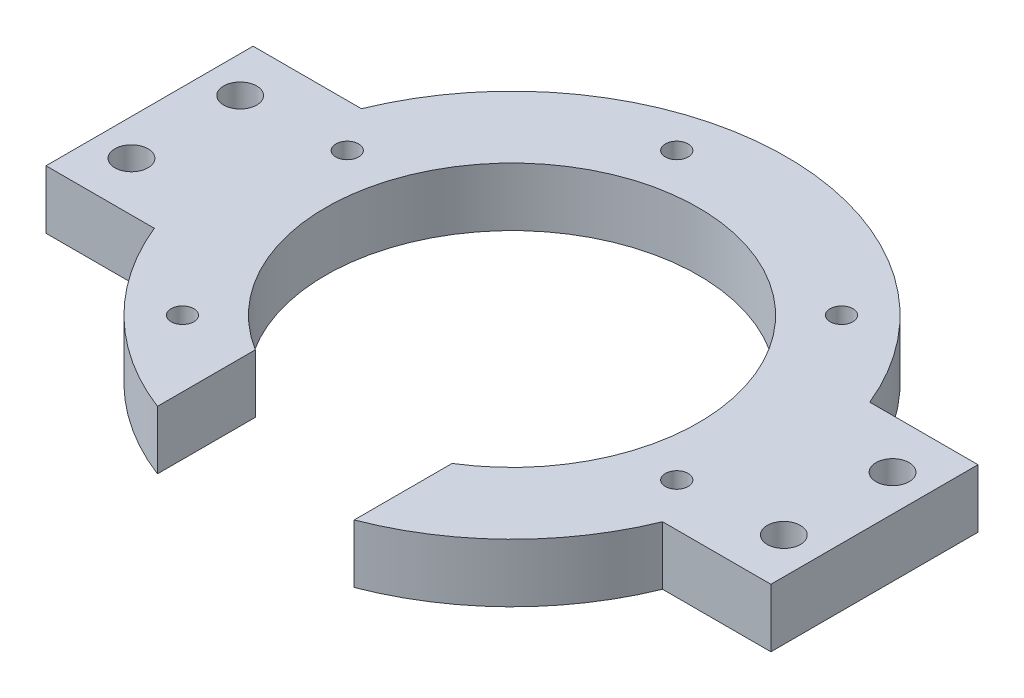
from build123d import *

# Parameters (mm, degrees)
SKETCH1_W                                  = 53
SKETCH1_H                                  = 11.3
SKETCH2_R                                  = 36
CUT_EXTRUDE1_DEPTH                         = 11.3
SKETCH3_W                                  = 38
SKETCH3_H                                  = 11.3
CUT_EXTRUDE2_DEPTH                         = 41.3
SKETCH5_R                                  = 2.2
CUT_EXTRUDE3_DEPTH                         = 76.800329815
CIRPATTERN1_COUNT                          = 3
BOSS_EXTRUDE1_START                        = -5
SKETCH6_W                                  = 40
SKETCH6_H                                  = 11.3
BOSS_EXTRUDE1_DEPTH                        = 22
SKETCH7_R                                  = 3.2
CUT_EXTRUDE4_DEPTH                         = 89.525081192
MIRROR2_AT_THE_SECOND_PLANE_COPY_1_SKETC_R = 3.2
MIRROR2_AT_THE_SECOND_PLANE_COPY_1_DEPTH   = 89.525081192


with BuildPart() as part:
    # Sketch1 → Revolve1 (revolve)
    with BuildSketch(Plane(origin=(0, 0, 0), x_dir=(0, 0, -1), z_dir=(1, 0, 0)), mode=Mode.PRIVATE) as revolve1_sk:
        with Locations((26.5, 5.65)):
            Rectangle(SKETCH1_W, SKETCH1_H)
    revolve(revolve1_sk.sketch.rotate(Axis((0, 28.592836715, 0), (0, -1, 0)), 180), axis=Axis((0, 28.592836715, 0), (0, -1, 0)))

    # Sketch2 → Cut-Extrude1 (cut)
    with BuildSketch(Plane(origin=(0, 11.3, 0), x_dir=(1, 0, 0), z_dir=(0, 1, 0))):
        with Locations(Location((0, 0, 0), (0, 0, 270))):
            Circle(SKETCH2_R)
    extrude(amount=-CUT_EXTRUDE1_DEPTH, mode=Mode.SUBTRACT)

    # Sketch3 → Cut-Extrude2 (cut)
    with BuildSketch(Plane.XY.offset(53)):
        with Locations((0, 5.65)):
            Rectangle(SKETCH3_W, SKETCH3_H)
    extrude(amount=-CUT_EXTRUDE2_DEPTH, mode=Mode.SUBTRACT)

    # Sketch5 → Cut-Extrude3 (cut, through all)
    with BuildSketch(Plane(origin=(0, 11.3, 0), x_dir=(1, 0, 0), z_dir=(0, 1, 0))):
        with Locations((11.64685703, -43.466662183)):
            Circle(SKETCH5_R)
        with Locations(Location((-11.64685703, 43.466662183, 0), (0, 0, 270))):
            Circle(SKETCH5_R)
    cut_extrude3 = extrude(amount=-CUT_EXTRUDE3_DEPTH, mode=Mode.SUBTRACT)

    # CirPattern1: Cut-Extrude3 ×3 about axis
    cirpattern1_axis = Axis((0, 0, 0), (0, 1, 0))
    for i in range(1, CIRPATTERN1_COUNT):
        add(cut_extrude3.rotate(cirpattern1_axis, i * 360 / CIRPATTERN1_COUNT), mode=Mode.SUBTRACT)

    # Sketch6 → Boss-Extrude1 (add)
    with BuildSketch(Plane(origin=(53, 0, 0), x_dir=(0, 0, -1), z_dir=(1, 0, 0)).offset(BOSS_EXTRUDE1_START)):
        with Locations((0, 5.65)):
            Rectangle(SKETCH6_W, SKETCH6_H)
    boss_extrude1 = extrude(amount=BOSS_EXTRUDE1_DEPTH)

    # Mirror1: Boss-Extrude1 across plane
    add(boss_extrude1.mirror(Plane(origin=(0, 0, 0), x_dir=(0, 0, 1), z_dir=(1, 0, 0))))

    # Sketch7 → Cut-Extrude4 (cut, through all)
    with BuildSketch(Plane(origin=(0, 11.3, 0), x_dir=(1, 0, 0), z_dir=(0, 1, 0))):
        with Locations(Location((63, 10.5, 0), (0, 0, 270))):
            Circle(SKETCH7_R)
    cut_extrude4 = extrude(amount=-CUT_EXTRUDE4_DEPTH, mode=Mode.SUBTRACT)

    # Mirror2: Cut-Extrude4 across plane
    add(cut_extrude4.mirror(Plane(origin=(0, 0, 0), x_dir=(0, 0, 1), z_dir=(1, 0, 0))), mode=Mode.SUBTRACT)

    # Mirror2 at the second plane: Cut-Extrude4 across plane
    add(cut_extrude4.mirror(Plane.XY), mode=Mode.SUBTRACT)

    # Mirror2 at the second plane copy 1 sketc → Mirror2 at the second plane copy 1 (cut, through all)
    with BuildSketch(Plane(origin=(0, 11.3, 0), x_dir=(-1, 0, 0), z_dir=(0, 1, 0))):
        with Locations(Location((63, 10.5, 0), (0, 0, 270))):
            Circle(MIRROR2_AT_THE_SECOND_PLANE_COPY_1_SKETC_R)
    extrude(amount=-MIRROR2_AT_THE_SECOND_PLANE_COPY_1_DEPTH, mode=Mode.SUBTRACT)


solid = part.part
